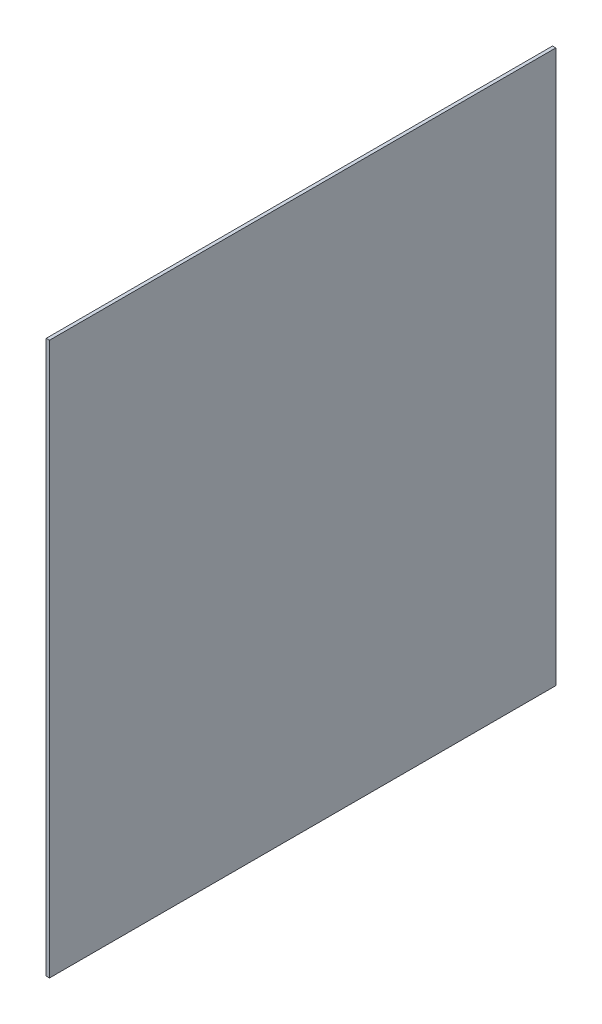
from build123d import *

# Parameters (mm, degrees)
SKETCH1_W           = 1955.8
SKETCH1_H           = 2133.6
BOSS_EXTRUDE1_DEPTH = 12.7


with BuildPart() as part:
    # Sketch1 → Boss-Extrude1 (new body)
    with BuildSketch(Plane(origin=(0, 0, 0), x_dir=(0, 0, -1), z_dir=(1, 0, 0))):
        with Locations((977.9, 1066.8)):
            Rectangle(SKETCH1_W, SKETCH1_H)
    extrude(amount=BOSS_EXTRUDE1_DEPTH)


solid = part.part
